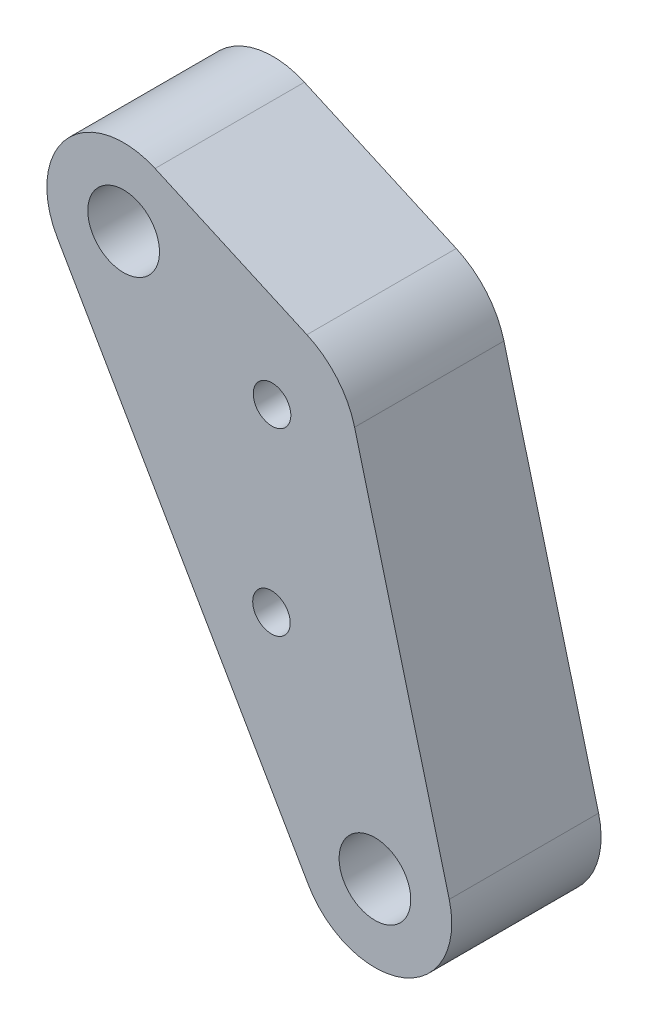
from build123d import *

# Parameters (mm, degrees)
BOSS_EXTRUDE1_DEPTH = 17.5
CUT_EXTRUDE1_DEPTH  = 1
HOLE1_D             = 4.4
HOLE2_D             = 4.4
HOLE3_D             = 8.4
HOLE4_D             = 8.4
FILLET1_R           = 10


with BuildPart() as part:
    # Sketch1 → Boss-Extrude1 (new body)
    with BuildSketch(Plane.XY.offset(17.5)):
        with BuildLine():
            Line((8.706689755, -31.721063073), (-3.596567561, 15.283592096))
            Line((-3.596567561, 15.283592096), (-25.765781543, 25.213668746))
            ThreePointArc((-25.765781543, 25.213668746), (-36.126401787, 23.029680686), (-37.239092363, 12.5))
            Line((-37.239092363, 12.5), (-7.794228634, -38.5))
            ThreePointArc((-7.794228634, -38.5), (3.420035495, -42.324863795), (8.706689755, -31.721063073))
        make_face()
    extrude(amount=-BOSS_EXTRUDE1_DEPTH)

    # Sketch2 → Cut-Extrude1 (cut)
    with BuildSketch(Plane(origin=(-22.516660498, -13, 0), x_dir=(0, 0, 1), z_dir=(-0.866025403784438, -0.500000000000001, 0))):
        with BuildLine():
            Line((9.791987556, 18.365854028), (10.909334809, 19.444863729))
            Line((10.909334809, 19.444863729), (9.791987556, 20.523873429))
            ThreePointArc((9.791987556, 20.523873429), (7.25, 19.444863729), (9.791987556, 18.365854028))
        make_face()
    extrude(amount=-CUT_EXTRUDE1_DEPTH, mode=Mode.SUBTRACT)

    # Hole1 (through all)
    with Locations(Plane(origin=(0, 0, 0), x_dir=(-1, 0, 0), z_dir=(0, 0, -1))):
        with Locations((12.057368355, 8.116025404)):
            Hole(HOLE1_D / 2)

    # Hole2 (through all)
    with Locations(Plane(origin=(0, 0, 0), x_dir=(-1, 0, 0), z_dir=(0, 0, -1))):
        with Locations((12.124355653, -13)):
            Hole(HOLE2_D / 2)

    # Hole3 (through all)
    with Locations(Plane(origin=(0, 0, 0), x_dir=(-1, 0, 0), z_dir=(0, 0, -1))):
        with Locations((0, -34)):
            Hole(HOLE3_D / 2)

    # Hole4 (through all)
    with Locations(Plane(origin=(0, 0, 0), x_dir=(-1, 0, 0), z_dir=(0, 0, -1))):
        with Locations((29.444863729, 17)):
            Hole(HOLE4_D / 2)

    # Fillet1
    fillet1_edges = [part.edges().sort_by_distance(p)[0] for p in [
        (-3.596567561, 15.283592096, 8.75),
    ]]
    fillet(fillet1_edges, radius=FILLET1_R)


solid = part.part
